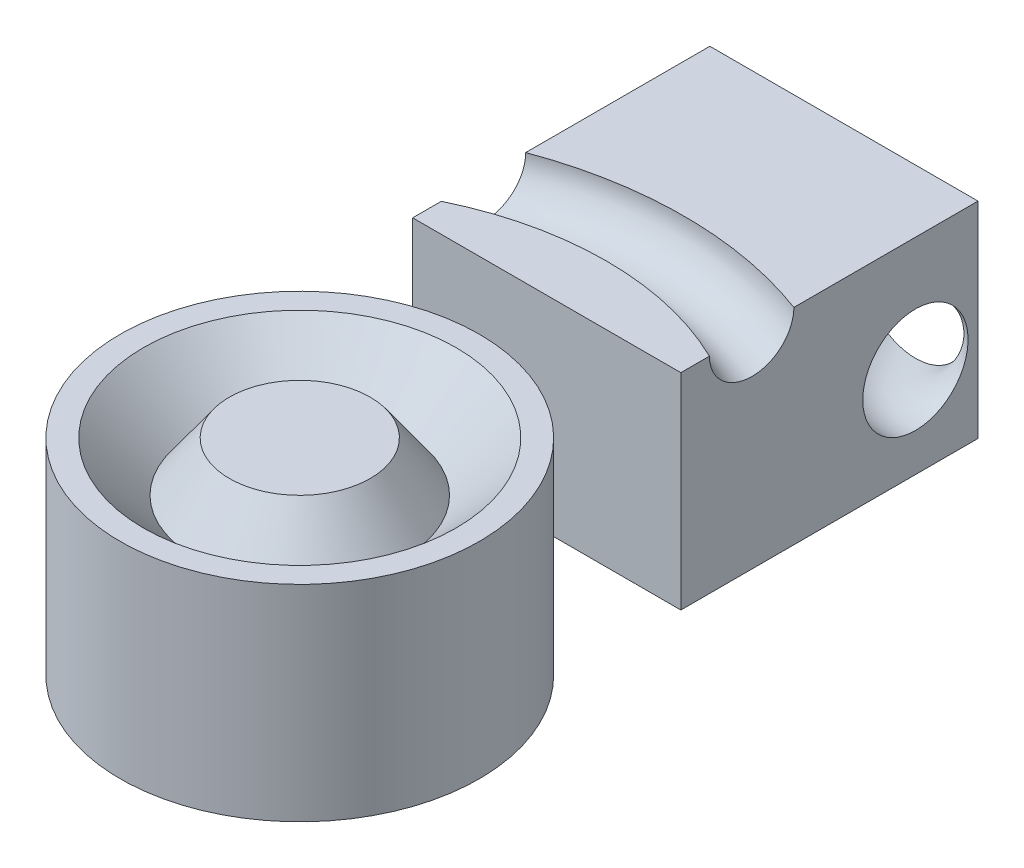
from build123d import *

# Parameters (mm, degrees)
SKETCH1_W           = 58.68704402
SKETCH1_H           = 67.209255033
SKETCH2_W           = 87.660679444
SKETCH2_H           = 97.137509655
BOSS_EXTRUDE1_DEPTH = 67.209255033
SKETCH3_R           = 12.7
SKETCH4_R           = 17.207386705


with BuildPart() as part:
    # Sketch1 → Revolve1 (revolve)
    with BuildSketch(Plane.XY, mode=Mode.PRIVATE) as revolve1_sk:
        with Locations((29.34352201, 33.604627517)):
            Rectangle(SKETCH1_W, SKETCH1_H)
    revolve(revolve1_sk.sketch.rotate(Axis((0, 0, 0), (0, 1, 0)), 90), axis=Axis((0, 0, 0), (0, 1, 0)))


with BuildPart() as body_2:
    # Sketch2 → Boss-Extrude1 (new body)
    with BuildSketch(Plane(origin=(0, 0, 0), x_dir=(1, 0, 0), z_dir=(0, 1, 0))):
        with Locations((0, 129.298002943)):
            Rectangle(SKETCH2_W, SKETCH2_H)
    extrude(amount=BOSS_EXTRUDE1_DEPTH)


with BuildPart() as cut_revolve1_tool:
    # Sketch3 → Cut-Revolve1 (revolve)
    with BuildSketch(Plane(origin=(0, 0, 0), x_dir=(0, 0, -1), z_dir=(1, 0, 0))):
        with Locations((112.877766248, 67.209255033)):
            Circle(SKETCH3_R)
        Polygon((23.034865904, 67.209255033), (34.619194029, 50.962115843), (51.094682917, 67.209255033), align=None)
    revolve(axis=Axis((0, 0, 0), (0, 1, 0)))


with BuildPart() as part_1:
    add(part.part)

    # Cut-Revolve1: cut by cut_revolve1_tool
    add(cut_revolve1_tool.part, mode=Mode.SUBTRACT)


with BuildPart() as body_2_1:
    add(body_2.part)

    # Cut-Revolve1: cut by cut_revolve1_tool
    add(cut_revolve1_tool.part, mode=Mode.SUBTRACT)

    # Sketch4 → Cut-Revolve2 (revolve, cut)
    with BuildSketch(Plane(origin=(43.830339722, 0, 0), x_dir=(0, 0, -1), z_dir=(1, 0, 0)), mode=Mode.PRIVATE) as cut_revolve2_sk:
        with Locations((157.413072149, 29.685041268)):
            Circle(SKETCH4_R)
    revolve(cut_revolve2_sk.sketch.rotate(Axis((43.830339722, 198.053018745, -177.86675777), (0, -1, 0)), 45), axis=Axis((43.830339722, 198.053018745, -177.86675777), (0, -1, 0)), mode=Mode.SUBTRACT)


solid = Compound([part_1.part, body_2_1.part])
